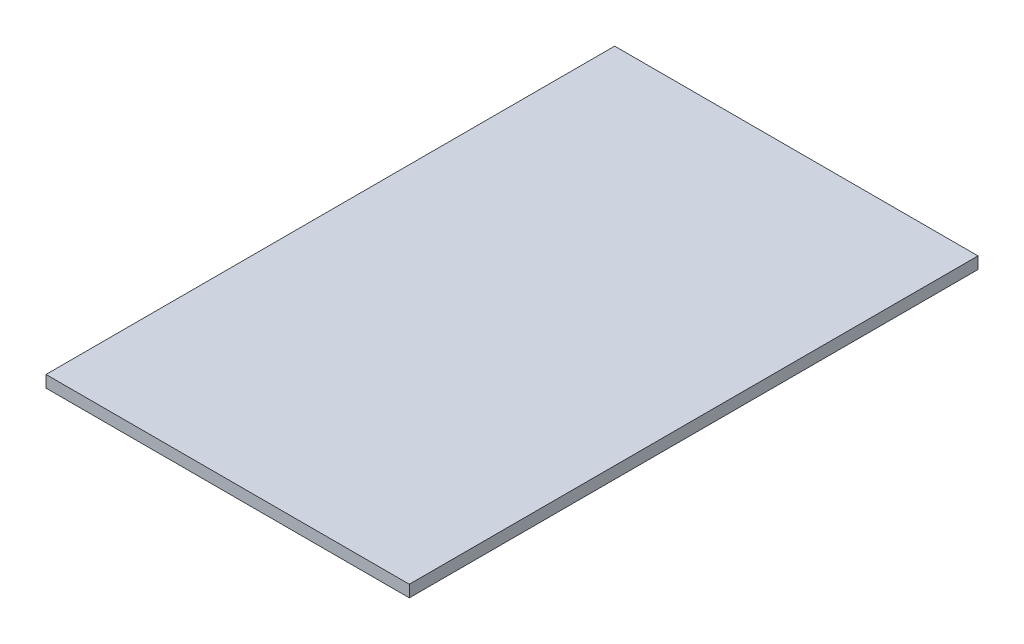
from build123d import *

# Parameters (mm, degrees)
SKETCH1_W           = 292.1
SKETCH1_H           = 457.2
BOSS_EXTRUDE1_DEPTH = 4.7625


with BuildPart() as part:
    # Sketch1 → Boss-Extrude1 (new, symmetric)
    with BuildSketch(Plane(origin=(0, 0, 0), x_dir=(1, 0, 0), z_dir=(0, 1, 0))):
        Rectangle(SKETCH1_W, SKETCH1_H)
    extrude(amount=BOSS_EXTRUDE1_DEPTH, both=True)


solid = part.part
